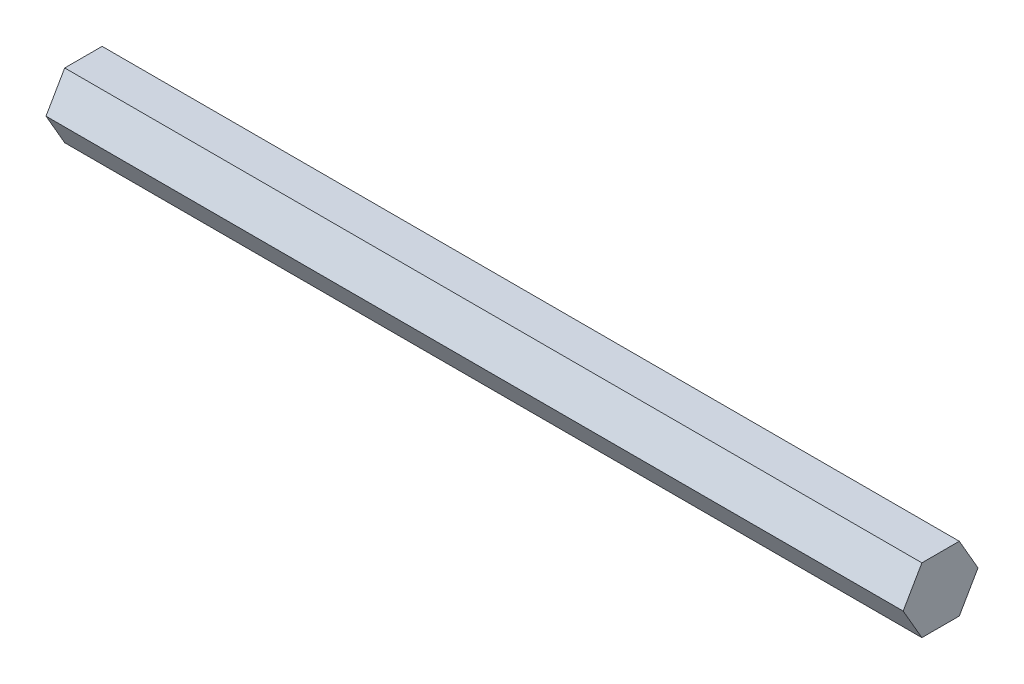
from build123d import *

# Parameters (mm, degrees)
SALIENTE_EXTRUIR1_DEPTH = 168


with BuildPart() as part:
    # Croquis1 → Saliente-Extruir1 (new body)
    with BuildSketch(Plane(origin=(0, 0, 0), x_dir=(0, 0, -1), z_dir=(1, 0, 0))):
        Polygon((7.332348419, 0), (3.666174209, 6.35), (-3.666174209, 6.35), (-7.332348419, 0), (-3.666174209, -6.35), (3.666174209, -6.35), align=None)
    extrude(amount=SALIENTE_EXTRUIR1_DEPTH)


solid = part.part
